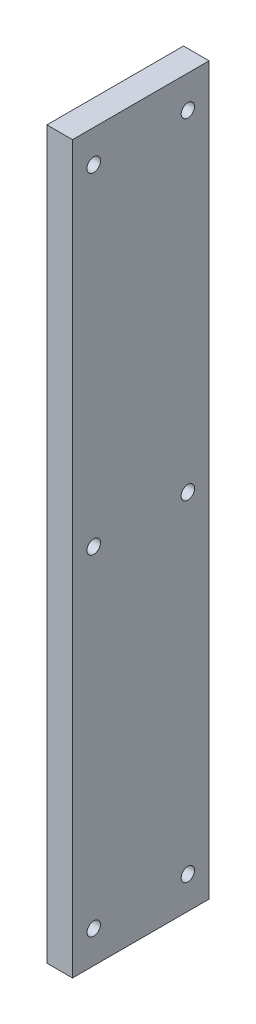
from build123d import *

# Parameters (mm, degrees)
CROQUIS1_W              = 50.8
CROQUIS1_H              = 270
SALIENTE_EXTRUIR1_DEPTH = 9.525
CROQUIS2_R              = 2.484871976
CROQUIS2_R_2            = 2.486243368
CROQUIS2_R_3            = 2.480816843
CROQUIS2_R_4            = 2.533555671
CROQUIS2_R_5            = 2.515105598
CROQUIS2_R_6            = 2.50801824
CORTAR_EXTRUIR1_DEPTH   = 9.525


with BuildPart() as part:
    # Croquis1 → Saliente-Extruir1 (new body)
    with BuildSketch(Plane(origin=(0, 0, 0), x_dir=(0, 0, -1), z_dir=(1, 0, 0))):
        Rectangle(CROQUIS1_W, CROQUIS1_H)
    extrude(amount=SALIENTE_EXTRUIR1_DEPTH)

    # Croquis2 → Cortar-Extruir1 (cut)
    with BuildSketch(Plane(origin=(9.525, 0, 0), x_dir=(0, 0, -1), z_dir=(1, 0, 0))):
        with Locations((-17.5, -123)):
            Circle(CROQUIS2_R)
        with Locations((17.5, -123)):
            Circle(CROQUIS2_R_2)
        with Locations((17.5, 123)):
            Circle(CROQUIS2_R_3)
        with Locations((-17.5, 123)):
            Circle(CROQUIS2_R_4)
        with Locations((-17.5, 0)):
            Circle(CROQUIS2_R_5)
        with Locations((17.5, 0)):
            Circle(CROQUIS2_R_6)
    extrude(amount=-CORTAR_EXTRUIR1_DEPTH, mode=Mode.SUBTRACT)


solid = part.part
